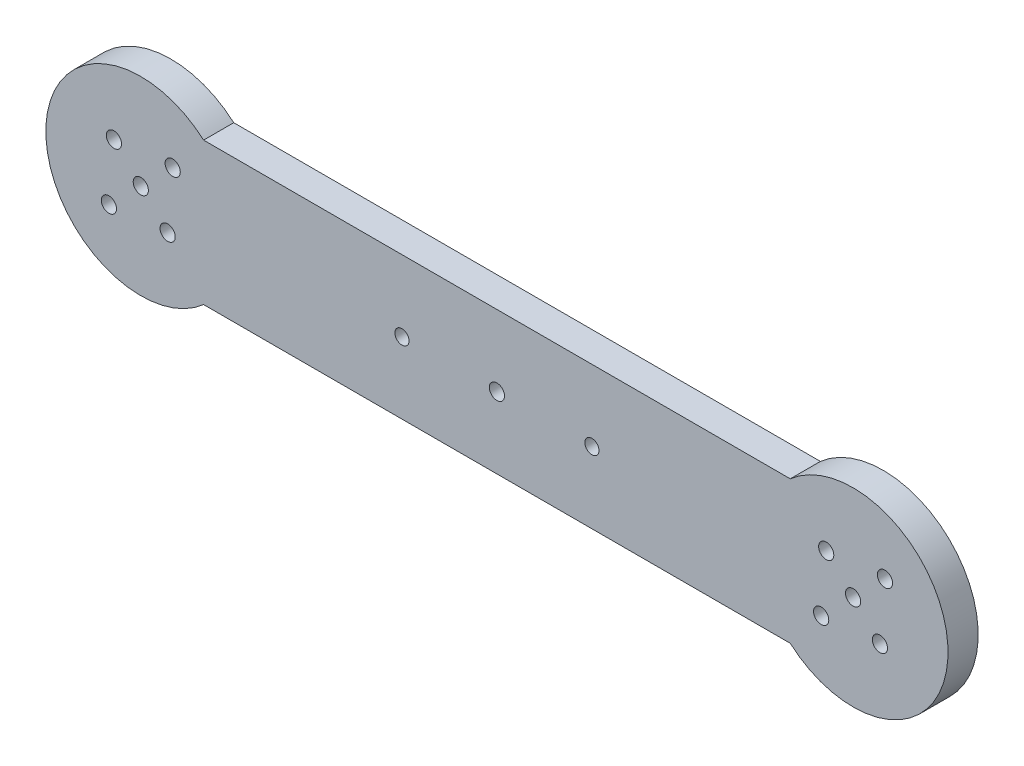
from build123d import *

# Parameters (mm, degrees)
SKETCH3_R                = 1.5
BOSS_EXTRUDE1_DEPTH      = 6.35
M3_CLEARANCE_HOLE1_D     = 3.2
M3_CLEARANCE_HOLE1_DEPTH = 7.5
M3_CLEARANCE_HOLE1_TIP   = 0.96137699


with BuildPart() as part:
    # Sketch3 → Boss-Extrude1 (new body)
    with BuildSketch(Plane.XY):
        with BuildLine():
            Line((61.771243445, -15), (-61.771243445, -15))
            ThreePointArc((-61.771243445, -15), (-95, 0), (-61.771243445, 15))
            Line((-61.771243445, 15), (61.771243445, 15))
            ThreePointArc((61.771243445, 15), (95, 0), (61.771243445, -15))
        make_face()
        with Locations((-20, 0)):
            Circle(SKETCH3_R, mode=Mode.SUBTRACT)
        with Locations((20, 0)):
            Circle(SKETCH3_R, mode=Mode.SUBTRACT)
    extrude(amount=BOSS_EXTRUDE1_DEPTH)

    # M3 Clearance Hole1
    with Locations(Plane.XY.offset(6.35)):
        with Locations((75, 0), (-75, 0), (-81.717514421, -6.717514421), (-69.343145751, -5.656854249), (-68.282485579, 6.717514421), (-80.656854249, 5.656854249), (0, 0), (81.717514421, 6.717514421), (69.343145751, 5.656854249), (68.282485579, -6.717514421), (80.656854249, -5.656854249)):
            Hole(M3_CLEARANCE_HOLE1_D / 2, depth=M3_CLEARANCE_HOLE1_DEPTH)
            with Locations((0, 0, -(M3_CLEARANCE_HOLE1_DEPTH + M3_CLEARANCE_HOLE1_TIP / 2))):  # 118° drill point
                Cone(0, M3_CLEARANCE_HOLE1_D / 2, M3_CLEARANCE_HOLE1_TIP, mode=Mode.SUBTRACT)


solid = part.part
